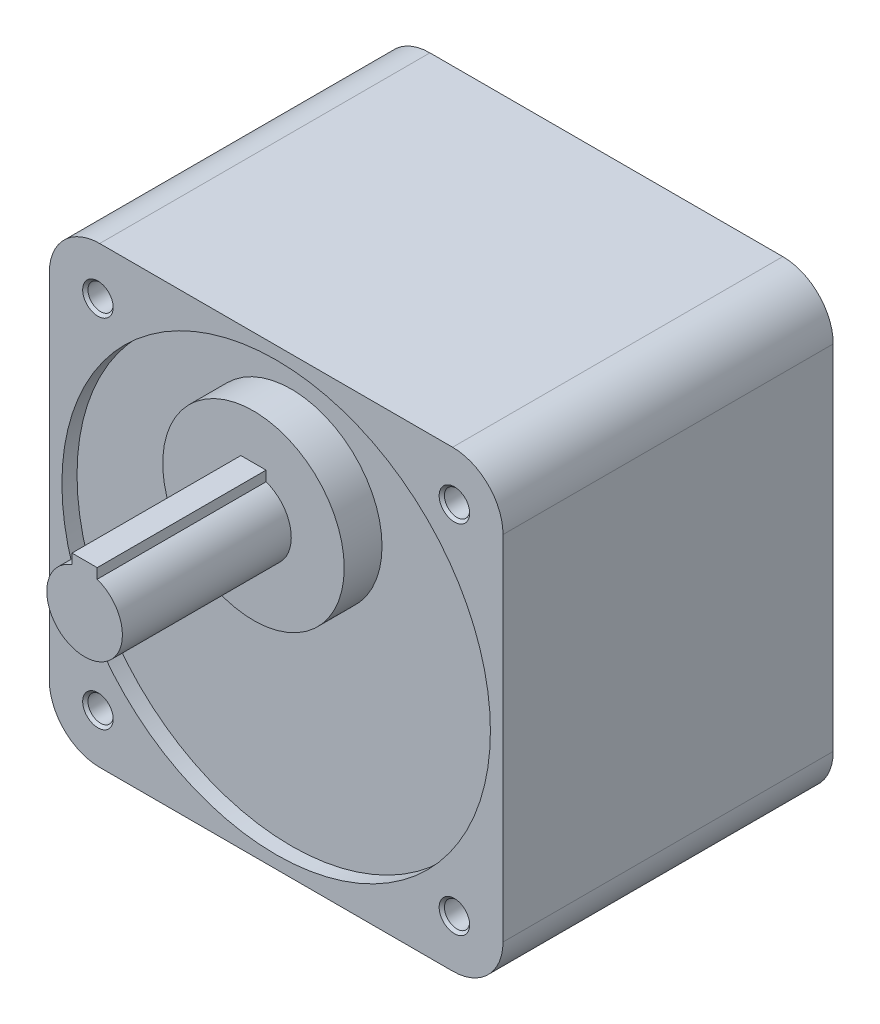
from build123d import *

# Parameters (mm, degrees)
SKETCH_1_W                   = 90
SKETCH_1_H                   = 90
EXTRUDE_2_DEPTH              = 65.5
SKETCH_2_R                   = 42.5
CUT_EXTRUDE_1_DEPTH          = 3
SKETCH_3_R                   = 18
EXTRUDE_3_DEPTH              = 7.5
SKETCH_4_R                   = 7.5
EXTRUDE_4_DEPTH              = 33.5
EXTRUDE_5_REACH              = 166.05
HOLE_WIZARD_M6_1_D           = 5
HOLE_WIZARD_M6_1_DEPTH       = 17
HOLE_WIZARD_M6_1_CSINK_D     = 6.05
HOLE_WIZARD_M6_1_CSINK_ANGLE = 90
HOLE_WIZARD_M6_1_TIP         = 1.502151548
FILLET_1_R                   = 10
HOLE_WIZARD_M6_2_D           = 5
HOLE_WIZARD_M6_2_DEPTH       = 17
HOLE_WIZARD_M6_2_CSINK_D     = 6.05
HOLE_WIZARD_M6_2_CSINK_ANGLE = 90
HOLE_WIZARD_M6_2_TIP         = 1.502151548


with BuildPart() as part:
    # 草图1 → 凸台-拉伸2 (new body)
    with BuildSketch(Plane.XY):
        with Locations((45, -45)):
            Rectangle(SKETCH_1_W, SKETCH_1_H)
    extrude(amount=EXTRUDE_2_DEPTH)

    # 草图2 → 切除-拉伸1 (cut)
    with BuildSketch(Plane.XY.offset(65.5)):
        with Locations((45, -45)):
            Circle(SKETCH_2_R)
    extrude(amount=-CUT_EXTRUDE_1_DEPTH, mode=Mode.SUBTRACT)

    # 草图3 → 凸台-拉伸3 (add)
    with BuildSketch(Plane.XY.offset(62.5)):
        with Locations((45, -27)):
            Circle(SKETCH_3_R)
    extrude(amount=EXTRUDE_3_DEPTH)

    # 草图4 → 凸台-拉伸4 (add)
    with BuildSketch(Plane.XY.offset(70)):
        with Locations((45, -27)):
            Circle(SKETCH_4_R)
    extrude(amount=EXTRUDE_4_DEPTH)

    # 草图5 → 凸台-拉伸5 (add, up to next)
    with BuildSketch(Plane.XY.offset(103.5), mode=Mode.PRIVATE) as extrude_5_sk1:
        with BuildLine():
            Line((42.5, -19.928932188), (42.5, -17.928932188))
            Line((42.5, -17.928932188), (47.5, -17.928932188))
            Line((47.5, -17.928932188), (47.5, -19.928932188))
            ThreePointArc((47.5, -19.928932188), (45, -19.5), (42.5, -19.928932188))
        make_face()
    extrude_5_tool1 = extrude(extrude_5_sk1.sketch, amount=-EXTRUDE_5_REACH, mode=Mode.PRIVATE) - part.part
    add(extrude_5_tool1.solids().sort_by_distance((45, -18.789851, 103.5))[0])

    # M6 螺纹孔1
    with Locations(Plane.XY.offset(65.5)):
        with Locations((9.644660941, -9.644660941), (80.355339059, -9.644660941), (9.644660941, -80.355339059), (80.355339059, -80.355339059)):
            CounterSinkHole(HOLE_WIZARD_M6_1_D / 2, HOLE_WIZARD_M6_1_CSINK_D / 2, depth=HOLE_WIZARD_M6_1_DEPTH, counter_sink_angle=HOLE_WIZARD_M6_1_CSINK_ANGLE)
            with Locations((0, 0, -(HOLE_WIZARD_M6_1_DEPTH + HOLE_WIZARD_M6_1_TIP / 2))):  # 118° drill point
                Cone(0, HOLE_WIZARD_M6_1_D / 2, HOLE_WIZARD_M6_1_TIP, mode=Mode.SUBTRACT)

    # 圆角1
    fillet_1_edges = [part.edges().sort_by_distance(p)[0] for p in [
        (0, 0, 32.75),
        (90, 0, 32.75),
        (90, -90, 32.75),
        (0, -90, 32.75),
    ]]
    fillet(fillet_1_edges, radius=FILLET_1_R)

    # M6 螺纹孔2
    with Locations(Plane(origin=(0, 0, 0), x_dir=(-1, 0, 0), z_dir=(0, 0, -1))):
        with Locations((-9.602967378, -80.397032622), (-80.31359627, -9.68640373), (-9.602967378, -9.602967378), (-80.31359627, -80.31359627)):
            CounterSinkHole(HOLE_WIZARD_M6_2_D / 2, HOLE_WIZARD_M6_2_CSINK_D / 2, depth=HOLE_WIZARD_M6_2_DEPTH, counter_sink_angle=HOLE_WIZARD_M6_2_CSINK_ANGLE)
            with Locations((0, 0, -(HOLE_WIZARD_M6_2_DEPTH + HOLE_WIZARD_M6_2_TIP / 2))):  # 118° drill point
                Cone(0, HOLE_WIZARD_M6_2_D / 2, HOLE_WIZARD_M6_2_TIP, mode=Mode.SUBTRACT)


solid = part.part
